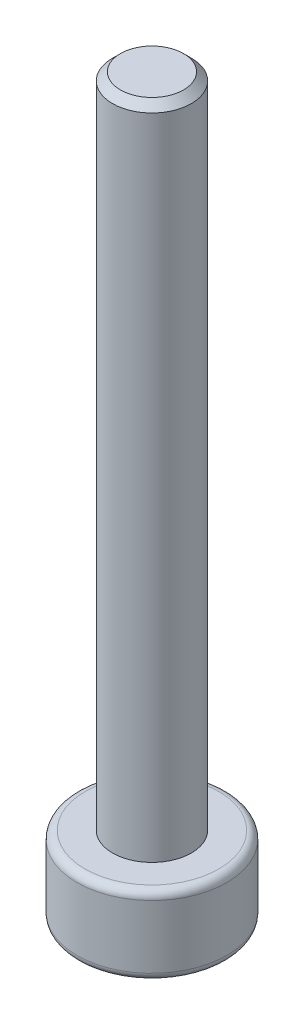
from build123d import *

# Parameters (mm, degrees)
SKETCH_1_R          = 2.85
EXTRUDE_1_DEPTH     = 3
SKETCH_2_R          = 1.5
EXTRUDE_2_DEPTH     = 25
SKETCH_3_R          = 1.29
CUT_EXTRUDE_1_DEPTH = 1.3
FILLET_1_R          = 0.3
CHAMFER_1_SIZE      = 0.3
CHAMFER_2_SIZE      = 0.15


with BuildPart() as part:
    # 草图1 → 凸台-拉伸1 (new body)
    with BuildSketch(Plane(origin=(0, 0, 0), x_dir=(1, 0, 0), z_dir=(0, 1, 0))):
        with Locations(Location((0, 0, 0), (0, 0, 270))):
            Circle(SKETCH_1_R)
    extrude(amount=EXTRUDE_1_DEPTH)

    # 草图2 → 凸台-拉伸2 (add)
    with BuildSketch(Plane(origin=(0, 3, 0), x_dir=(1, 0, 0), z_dir=(0, 1, 0))):
        with Locations(Location((0, 0, 0), (0, 0, 270))):
            Circle(SKETCH_2_R)
    extrude(amount=EXTRUDE_2_DEPTH)

    # 草图3 → 切除-拉伸1 (cut)
    with BuildSketch(Plane.XZ):
        with Locations(Location((0, 0, 0), (0, 0, 270))):
            Circle(SKETCH_3_R)
    extrude(amount=-CUT_EXTRUDE_1_DEPTH, mode=Mode.SUBTRACT)

    # 圆角1
    fillet_1_edges = [part.edges().sort_by_distance(p)[0] for p in [
        (0, 0, -2.85),
        (0, 3, -2.85),
    ]]
    fillet(fillet_1_edges, radius=FILLET_1_R)

    # 倒角1
    chamfer_1_edges = [part.edges().sort_by_distance(p)[0] for p in [
        (0, 28, -1.5),
    ]]
    chamfer(chamfer_1_edges, length=CHAMFER_1_SIZE)

    # 倒角2
    chamfer_2_edges = [part.edges().sort_by_distance(p)[0] for p in [
        (0, 0, 1.29),
    ]]
    chamfer(chamfer_2_edges, length=CHAMFER_2_SIZE)


solid = part.part
